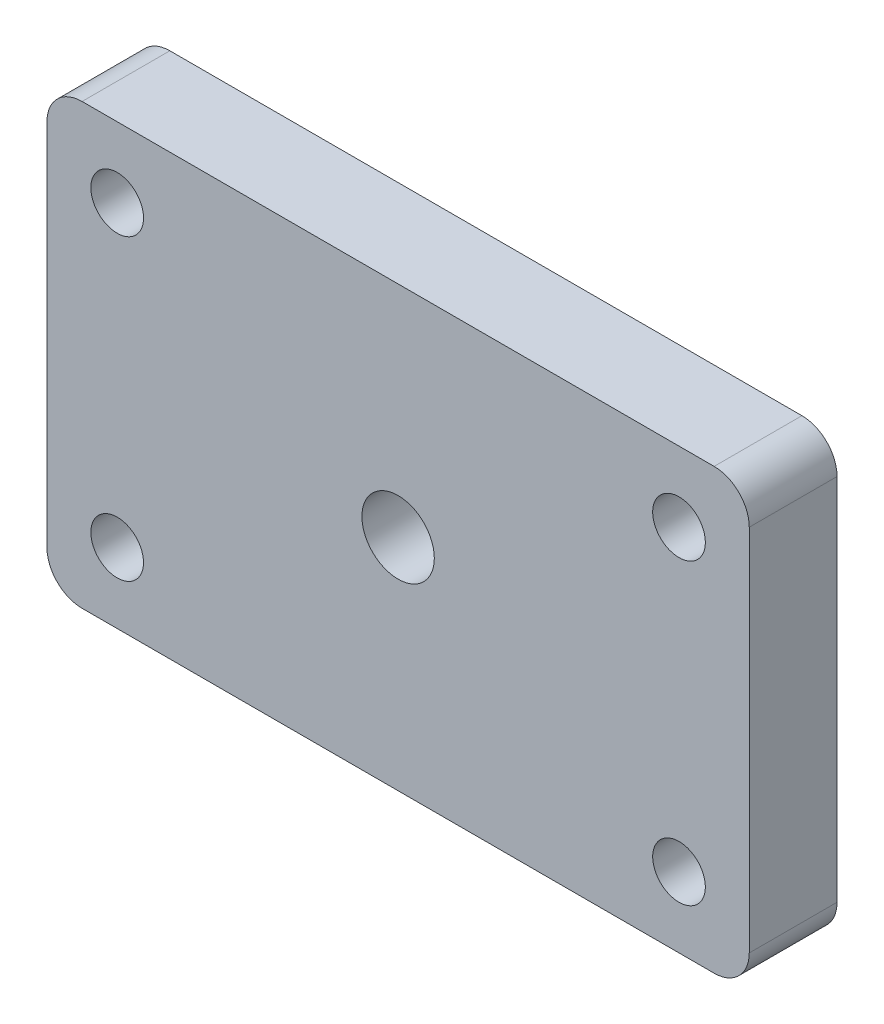
from build123d import *

# Parameters (mm, degrees)
MODEL_R             = 3
MODEL_R_2           = 4.125
BOSS_EXTRUDE1_DEPTH = 10


with BuildPart() as part:
    # Model → Boss-Extrude1 (new body)
    with BuildSketch(Plane.XY):
        with BuildLine():
            Line((36, -25), (-36, -25))
            ThreePointArc((-36, -25), (-38.828427125, -23.828427125), (-40, -21))
            Line((-40, -21), (-40, 21))
            ThreePointArc((-40, 21), (-38.828427125, 23.828427125), (-36, 25))
            Line((-36, 25), (36, 25))
            ThreePointArc((36, 25), (38.828427125, 23.828427125), (40, 21))
            Line((40, 21), (40, -21))
            ThreePointArc((40, -21), (38.828427125, -23.828427125), (36, -25))
        make_face()
        with Locations((32, 17)):
            Circle(MODEL_R, mode=Mode.SUBTRACT)
        with Locations((-32, 17)):
            Circle(MODEL_R, mode=Mode.SUBTRACT)
        with Locations((32, -17)):
            Circle(MODEL_R, mode=Mode.SUBTRACT)
        Circle(MODEL_R_2, mode=Mode.SUBTRACT)
        with Locations((-32, -17)):
            Circle(MODEL_R, mode=Mode.SUBTRACT)
    extrude(amount=BOSS_EXTRUDE1_DEPTH)


solid = part.part
